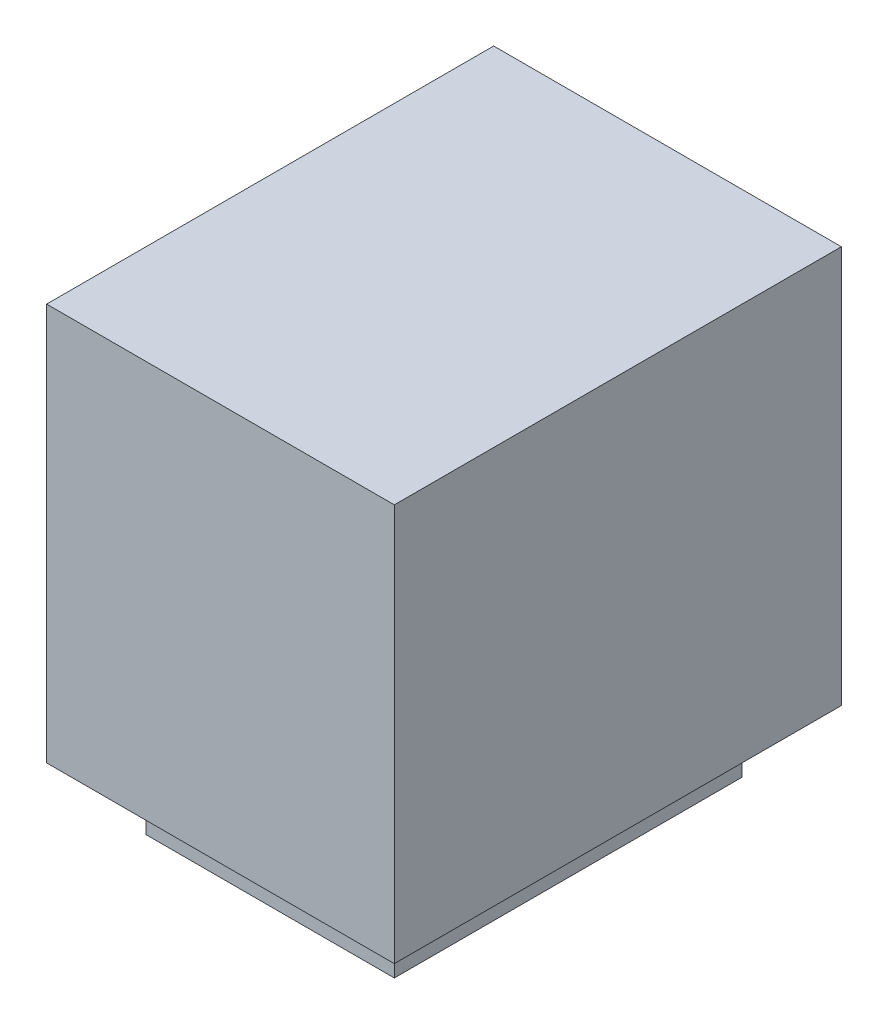
from build123d import *

# Parameters (mm, degrees)
SKETCH1_W           = 1400
SKETCH1_H           = 1800
BOSS_EXTRUDE1_DEPTH = 1600
SKETCH2_W           = 1000
SKETCH2_H           = 1400
BOSS_EXTRUDE2_DEPTH = 250
SKETCH3_W           = 800
SKETCH3_H           = 1000
CUT_EXTRUDE1_DEPTH  = 50
SKETCH4_W           = 500
SKETCH4_H           = 350
BOSS_EXTRUDE3_DEPTH = 50


with BuildPart() as part:
    # Sketch1 → Boss-Extrude1 (new body)
    with BuildSketch(Plane(origin=(0, 0, 0), x_dir=(1, 0, 0), z_dir=(0, 1, 0))):
        Rectangle(SKETCH1_W, SKETCH1_H)
    extrude(amount=BOSS_EXTRUDE1_DEPTH)

    # Sketch2 → Boss-Extrude2 (add)
    with BuildSketch(Plane(origin=(0, 0, 0), x_dir=(1, 0, 0), z_dir=(0, 1, 0))):
        Rectangle(SKETCH2_W, SKETCH2_H)
    extrude(amount=-BOSS_EXTRUDE2_DEPTH)

    # Sketch3 → Cut-Extrude1 (cut)
    with BuildSketch(Plane.XY):
        with Locations((7.862922359, 800.806757739)):
            Rectangle(SKETCH3_W, SKETCH3_H)
    extrude(amount=-CUT_EXTRUDE1_DEPTH, mode=Mode.SUBTRACT)

    # Sketch4 → Boss-Extrude3 (add)
    with BuildSketch(Plane.XY):
        with Locations((23.588767076, 824.395524815)):
            Rectangle(SKETCH4_W, SKETCH4_H)
    extrude(amount=-BOSS_EXTRUDE3_DEPTH)


solid = part.part
